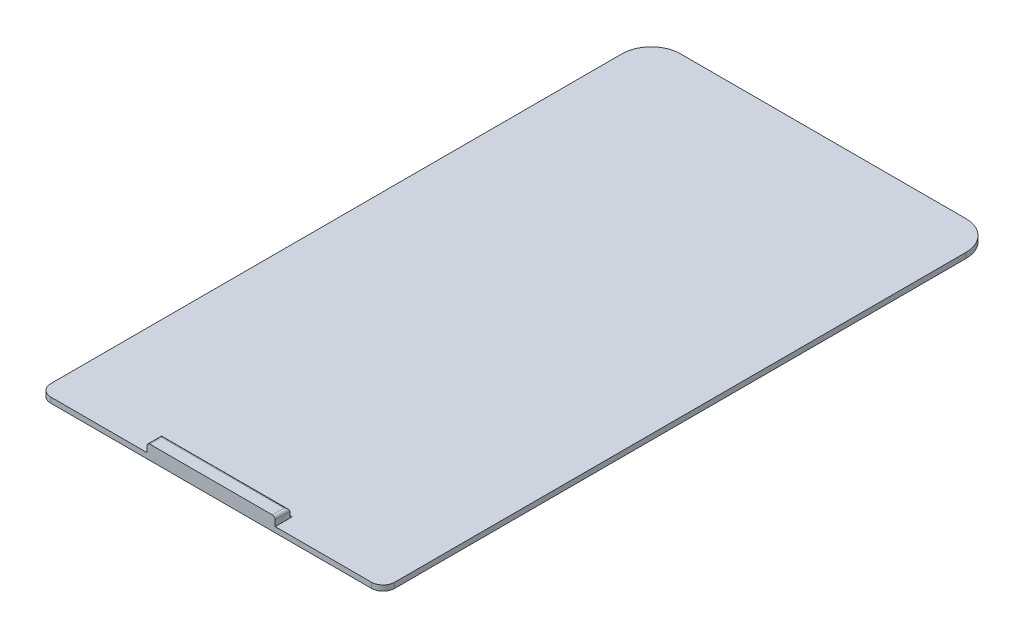
from build123d import *

# Parameters (mm, degrees)
SKETCH2_W           = 59
SKETCH2_H           = 105
BOSS_EXTRUDE1_DEPTH = 0.925
SKETCH3_W           = 22
SKETCH3_H           = 2.5
BOSS_EXTRUDE2_DEPTH = 1.5
FILLET1_R           = 0.5
FILLET2_R           = 2
FILLET3_R           = 5


with BuildPart() as part:
    # Sketch2 → Boss-Extrude1 (new body)
    with BuildSketch(Plane(origin=(0, 0, 0), x_dir=(1, 0, 0), z_dir=(0, 1, 0))):
        with Locations((-29.5, 52.5)):
            Rectangle(SKETCH2_W, SKETCH2_H)
    extrude(amount=BOSS_EXTRUDE1_DEPTH)

    # Sketch3 → Boss-Extrude2 (add)
    with BuildSketch(Plane(origin=(0, 0.925, 0), x_dir=(1, 0, 0), z_dir=(0, 1, 0))):
        with Locations((-29.5, 1.25)):
            Rectangle(SKETCH3_W, SKETCH3_H)
    extrude(amount=BOSS_EXTRUDE2_DEPTH)

    # Fillet1
    fillet1_edges = [part.edges().sort_by_distance(p)[0] for p in [
        (-29.5, 0.925, -2.5),
        (-40.5, 2.425, -1.25),
        (-18.5, 2.425, -1.25),
        (-29.5, 2.425, -2.5),
    ]]
    fillet(fillet1_edges, radius=FILLET1_R)

    # Fillet2
    fillet2_edges = [part.edges().sort_by_distance(p)[0] for p in [
        (0, 0.4625, 0),
        (-59, 0.4625, 0),
    ]]
    fillet(fillet2_edges, radius=FILLET2_R)

    # Fillet3
    fillet3_edges = [part.edges().sort_by_distance(p)[0] for p in [
        (-59, 0.4625, -105),
        (0, 0.4625, -105),
    ]]
    fillet(fillet3_edges, radius=FILLET3_R)


solid = part.part
